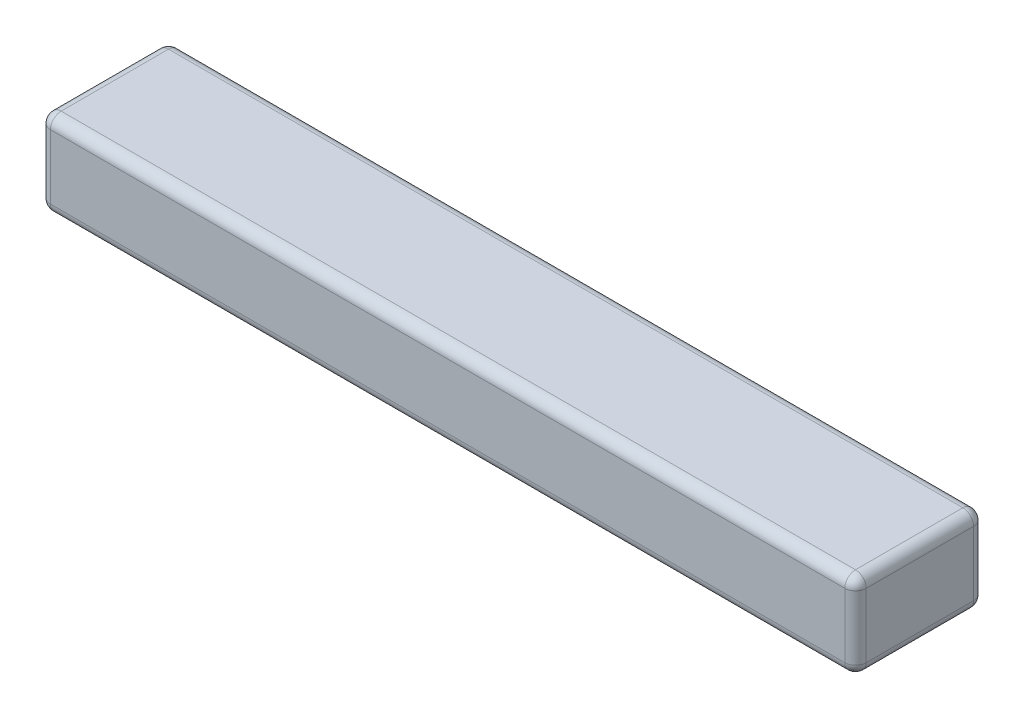
from build123d import *

# Parameters (mm, degrees)
SKETCH1_W           = 60
SKETCH1_H           = 40
BOSS_EXTRUDE1_DEPTH = 190
FILLET1_R           = 5


with BuildPart() as part:
    # Sketch1 → Boss-Extrude1 (new, symmetric)
    with BuildSketch(Plane(origin=(0, 0, 0), x_dir=(0, 0, -1), z_dir=(1, 0, 0))):
        Rectangle(SKETCH1_W, SKETCH1_H)
    extrude(amount=BOSS_EXTRUDE1_DEPTH, both=True)

    # Fillet1
    fillet1_edges = [part.edges().sort_by_distance(p)[0] for p in [
        (190, 0, 30),
        (190, -20, 0),
        (190, 0, -30),
        (-190, -20, 0),
        (-190, 0, 30),
        (-190, 20, 0),
        (-190, 0, -30),
        (190, 20, 0),
        (0, -20, -30),
        (0, -20, 30),
        (0, 20, 30),
        (0, 20, -30),
    ]]
    fillet(fillet1_edges, radius=FILLET1_R)


solid = part.part
